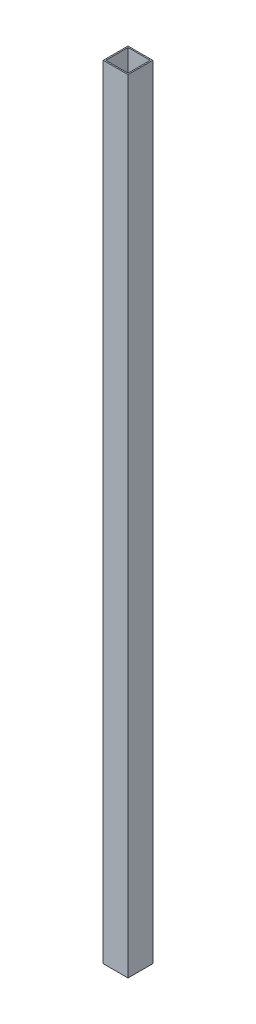
from build123d import *

# Parameters (mm, degrees)
SKETCH1_W           = 25.4
SKETCH1_H           = 25.4
BOSS_EXTRUDE1_DEPTH = 802.767
SKETCH3_W           = 22.86
SKETCH3_H           = 22.86
CUT_EXTRUDE1_DEPTH  = 804.57026842


with BuildPart() as part:
    # Sketch1 → Boss-Extrude1 (new body)
    with BuildSketch(Plane(origin=(0, 0, 0), x_dir=(1, 0, 0), z_dir=(0, 1, 0))):
        with Locations((12.7, 12.7)):
            Rectangle(SKETCH1_W, SKETCH1_H)
    extrude(amount=BOSS_EXTRUDE1_DEPTH)

    # Sketch3 → Cut-Extrude1 (cut, through all)
    with BuildSketch(Plane(origin=(0, 802.767, 0), x_dir=(1, 0, 0), z_dir=(0, 1, 0))):
        with Locations((12.7, 12.7)):
            Rectangle(SKETCH3_W, SKETCH3_H)
    extrude(amount=-CUT_EXTRUDE1_DEPTH, mode=Mode.SUBTRACT)


solid = part.part
